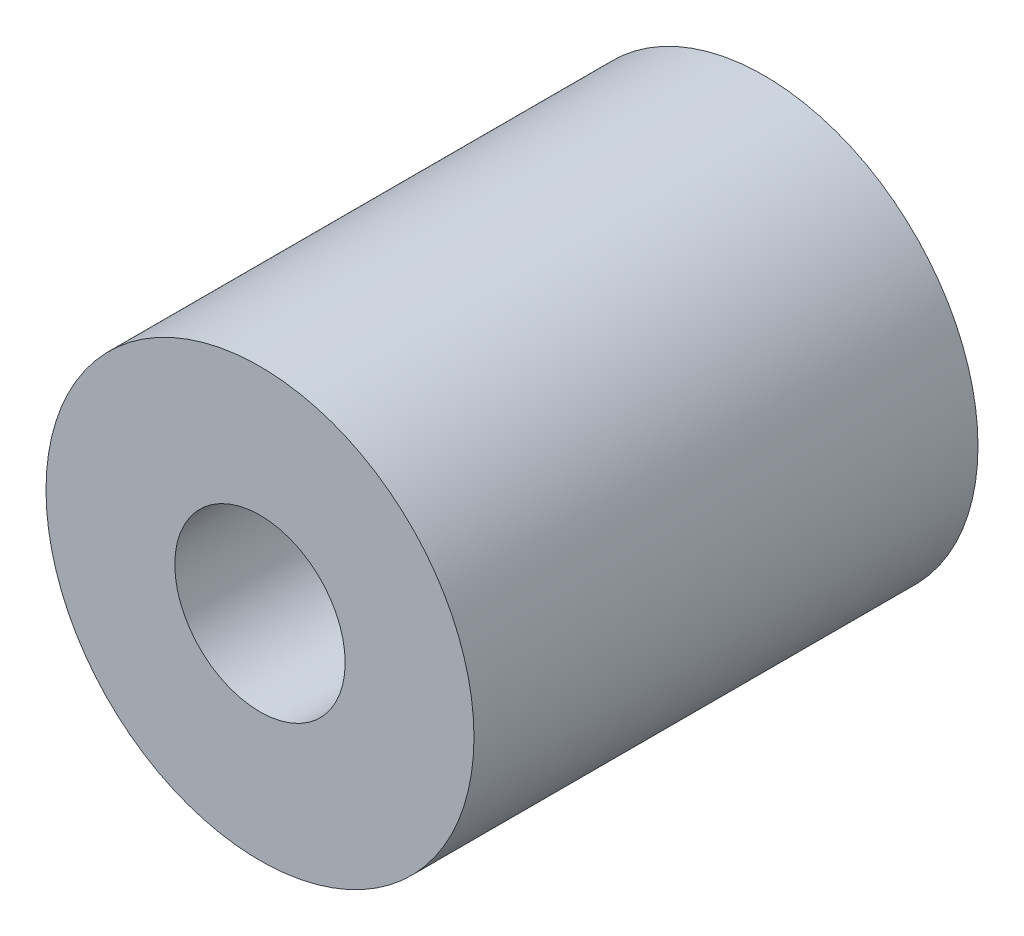
from build123d import *

# Parameters (mm, degrees)
CROQUIS1_R              = 4.984375
CROQUIS1_R_2            = 1.984375
SALIENTE_EXTRUIR1_DEPTH = 11.74


with BuildPart() as part:
    # Croquis1 → Saliente-Extruir1 (new body)
    with BuildSketch(Plane.XY):
        Circle(CROQUIS1_R)
        Circle(CROQUIS1_R_2, mode=Mode.SUBTRACT)
    extrude(amount=SALIENTE_EXTRUIR1_DEPTH)


solid = part.part
